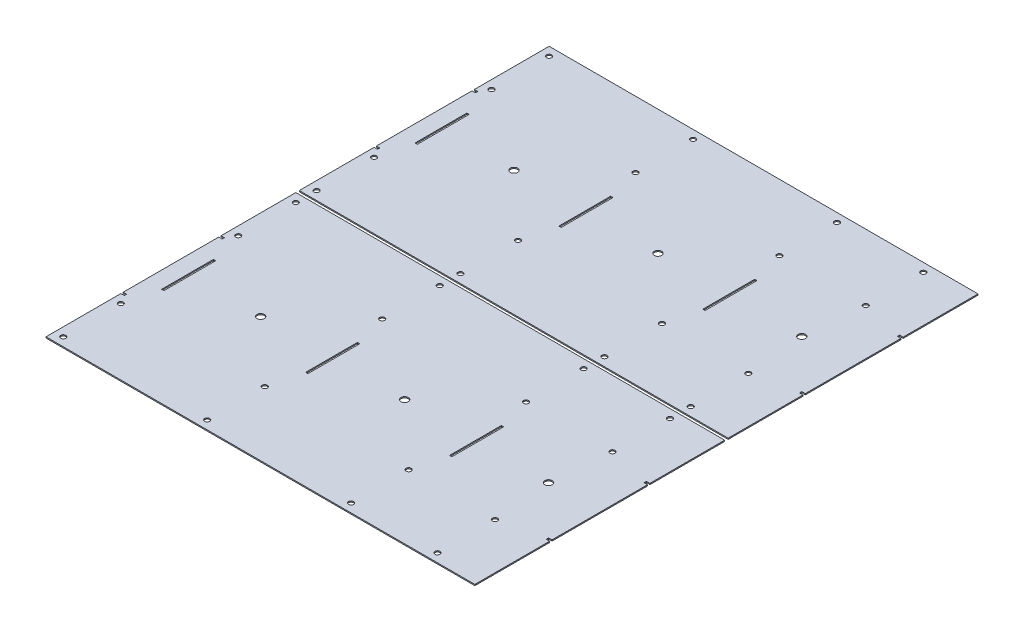
from build123d import *

# Parameters (mm, degrees)
SKETCH1_R           = 2.2
SKETCH1_R_2         = 3.175
SKETCH1_W           = 2
SKETCH1_H           = 45
BOSS_EXTRUDE1_DEPTH = 1
LPATTERN1_COUNT     = 2
LPATTERN1_PITCH     = 220


with BuildPart() as part:
    # Sketch1 → Boss-Extrude1 (new body)
    with BuildSketch(Plane(origin=(0, 0, 0), x_dir=(1, 0, 0), z_dir=(0, 1, 0))):
        Polygon((-15.5, -108.5), (357, -108.5), (357, -43.5), (354, -43.5), (354, -41.5), (357, -41.5), (357, 41.5), (354, 41.5), (354, 43.5), (357, 43.5), (357, 108.5), (-15.5, 108.5), (-15.5, 43.5), (-12.5, 43.5), (-12.5, 41.5), (-15.5, 41.5), (-15.5, -41.5), (-12.5, -41.5), (-12.5, -43.5), (-15.5, -43.5), align=None)
        with Locations(Location((-8, -101, 0), (0, 0, 270))):
            Circle(SKETCH1_R, mode=Mode.SUBTRACT)
        with Locations(Location((-8, -51, 0), (0, 0, 270))):
            Circle(SKETCH1_R, mode=Mode.SUBTRACT)
        with Locations(Location((-8, 51, 0), (0, 0, 90))):
            Circle(SKETCH1_R, mode=Mode.SUBTRACT)
        with Locations(Location((-8, 101, 0), (0, 0, 90))):
            Circle(SKETCH1_R, mode=Mode.SUBTRACT)
        with Locations(Location((117, -101, 0), (0, 0, 270))):
            Circle(SKETCH1_R, mode=Mode.SUBTRACT)
        with Locations(Location((117, -51, 0), (0, 0, 270))):
            Circle(SKETCH1_R, mode=Mode.SUBTRACT)
        with Locations(Location((117, 51, 0), (0, 0, 90))):
            Circle(SKETCH1_R, mode=Mode.SUBTRACT)
        with Locations(Location((117, 101, 0), (0, 0, 90))):
            Circle(SKETCH1_R, mode=Mode.SUBTRACT)
        with Locations(Location((242, -101, 0), (0, 0, 270))):
            Circle(SKETCH1_R, mode=Mode.SUBTRACT)
        with Locations(Location((242, -51, 0), (0, 0, 270))):
            Circle(SKETCH1_R, mode=Mode.SUBTRACT)
        with Locations(Location((242, 51, 0), (0, 0, 90))):
            Circle(SKETCH1_R, mode=Mode.SUBTRACT)
        with Locations(Location((242, 101, 0), (0, 0, 90))):
            Circle(SKETCH1_R, mode=Mode.SUBTRACT)
        with Locations(Location((62.5, 0, 0), (0, 0, 270))):
            Circle(SKETCH1_R_2, mode=Mode.SUBTRACT)
        with Locations(Location((187.5, 0, 0), (0, 0, 270))):
            Circle(SKETCH1_R_2, mode=Mode.SUBTRACT)
        with Locations(Location((312.5, 0, 0), (0, 0, 270))):
            Circle(SKETCH1_R_2, mode=Mode.SUBTRACT)
        with Locations(Location((317, 101, 0), (0, 0, 270))):
            Circle(SKETCH1_R, mode=Mode.SUBTRACT)
        with Locations(Location((317, 51, 0), (0, 0, 270))):
            Circle(SKETCH1_R, mode=Mode.SUBTRACT)
        with Locations(Location((317, -101, 0), (0, 0, 270))):
            Circle(SKETCH1_R, mode=Mode.SUBTRACT)
        with Locations(Location((317, -51, 0), (0, 0, 270))):
            Circle(SKETCH1_R, mode=Mode.SUBTRACT)
        with Locations((125, 0)):
            Rectangle(SKETCH1_W, SKETCH1_H, mode=Mode.SUBTRACT)
        Rectangle(SKETCH1_W, SKETCH1_H, mode=Mode.SUBTRACT)
        with Locations((250, 0)):
            Rectangle(SKETCH1_W, SKETCH1_H, mode=Mode.SUBTRACT)
    extrude(amount=BOSS_EXTRUDE1_DEPTH)


with BuildPart() as lpattern1_1:
    # LPattern1: pattern copy
    add(part.part.moved(Location(Vector(0, 0, -1) * (1 * LPATTERN1_PITCH))))


solid = Compound([part.part, lpattern1_1.part])
